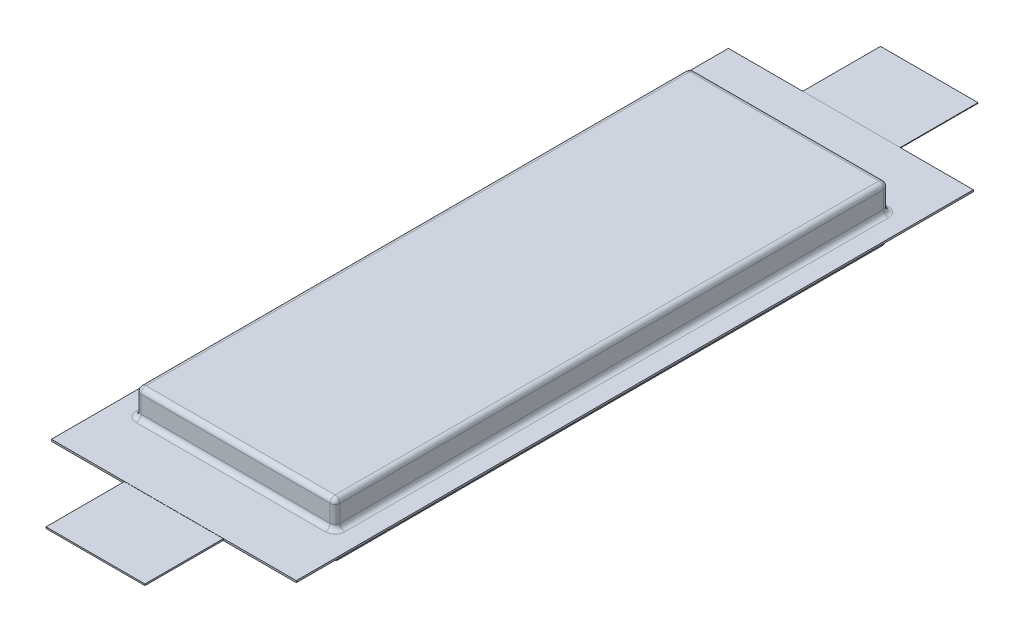
from build123d import *

# Parameters (mm, degrees)
SKETCH1_W                = 40.6
SKETCH1_H                = 113
BOSS_EXTRUDE2_DEPTH      = 11.4
SKETCH3_W                = 4.7
SKETCH3_H                = 0.01
BOSS_EXTRUDE3_DEPTH      = 1
BOSS_EXTRUDE4_DEPTH      = 0.185
BOSS_EXTRUDE4_DEPTH_BACK = 0.185
SKETCH4_W                = 50
SKETCH4_H                = 138.2
BOSS_EXTRUDE5_DEPTH      = 16
BOSS_EXTRUDE6_DEPTH      = 16
FILLET1_R                = 1


with BuildPart() as part:
    # Sketch1 → Boss-Extrude2 (new body)
    with BuildSketch(Plane(origin=(0, 0, 0), x_dir=(1, 0, 0), z_dir=(0, 1, 0))):
        with Locations((20.3, 56.5)):
            Rectangle(SKETCH1_W, SKETCH1_H)
    extrude(amount=BOSS_EXTRUDE2_DEPTH)



with BuildPart() as body_2:
    # Sketch3 → Boss-Extrude3 (new body)
    with BuildSketch(Plane.XY):
        with Locations((-2.35, 5.695)):
            Rectangle(SKETCH3_W, SKETCH3_H)
    extrude(amount=BOSS_EXTRUDE3_DEPTH)


with BuildPart() as part_1:
    add(part.part)

    add(body_2.part)  # Boss-Extrude4 merges body 2
    # Sketch4 → Boss-Extrude4 (add, two sides: drawn at the far end of the back side and taken through both)
    with BuildSketch(Plane(origin=(0, 5.7, 0), x_dir=(1, 0, 0), z_dir=(0, 1, 0)).offset(-BOSS_EXTRUDE4_DEPTH_BACK)):
        with Locations((20.3, 56.5)):
            Rectangle(SKETCH4_W, SKETCH4_H)
    extrude(amount=BOSS_EXTRUDE4_DEPTH + BOSS_EXTRUDE4_DEPTH_BACK)

    # Sketch5 → Boss-Extrude5 (add)
    with BuildSketch(Plane.XY.offset(12.6)):
        Polygon((30.4, 5.85), (20.3, 5.85), (10.2, 5.85), (10.2, 5.549950483), (30.4, 5.549950483), align=None)
    extrude(amount=BOSS_EXTRUDE5_DEPTH)

    # Sketch6 → Boss-Extrude6 (add)
    with BuildSketch(Plane(origin=(0, 0, -125.6), x_dir=(-1, 0, 0), z_dir=(0, 0, -1))):
        Polygon((-20.3, 5.765), (-10.35, 5.765), (-10.35, 5.635), (-30.25, 5.635), (-30.25, 5.765), align=None)
    extrude(amount=BOSS_EXTRUDE6_DEPTH)

    # Fillet1
    fillet1_edges = [part_1.edges().sort_by_distance(p)[0] for p in [
        (40.6, 11.4, -56.5),
        (20.3, 11.4, -113),
        (0, 2.7575, -113),
        (40.6, 2.7575, -113),
        (20.3, 5.885, -113),
        (20.3, 5.515, -113),
        (40.6, 2.7575, 0),
        (0, 2.7575, 0),
        (20.3, 5.885, 0),
        (0, 5.885, -56.5),
        (40.6, 5.885, -56.5),
        (20.3, 5.515, 0),
        (0, 5.515, -56.5),
        (40.6, 5.515, -56.5),
        (0, 11.4, -56.5),
        (20.3, 0, -113),
        (40.6, 0, -56.5),
        (20.3, 0, 0),
        (0, 0, -56.5),
        (20.3, 11.4, 0),
        (0, 8.6425, -113),
        (40.6, 8.6425, -113),
        (40.6, 8.6425, 0),
        (0, 8.6425, 0),
    ]]
    fillet(fillet1_edges, radius=FILLET1_R)


solid = part_1.part
